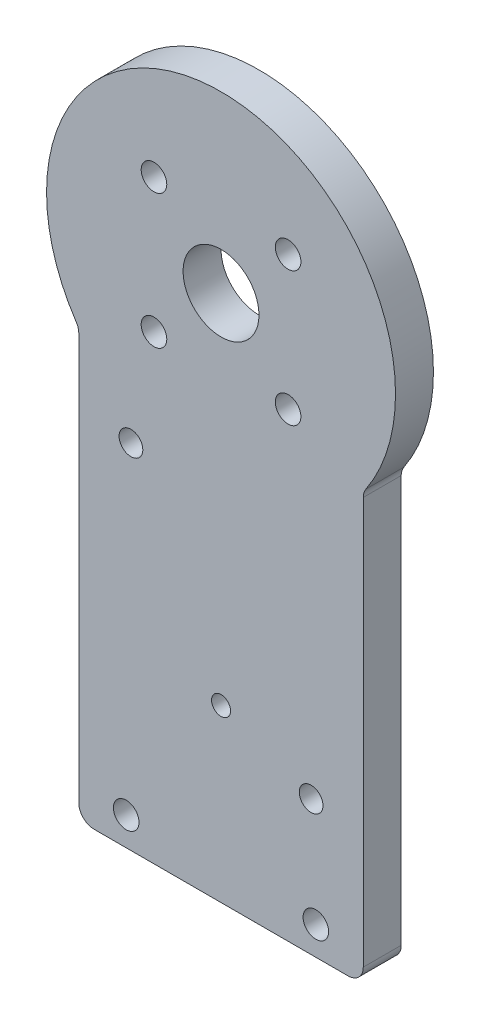
from build123d import *

# Parameters (mm, degrees)
CROQUIS1_R              = 1.35
CROQUIS1_R_2            = 4
CROQUIS1_R_3            = 1.25
SALIENTE_EXTRUIR1_DEPTH = 4
REDONDEO1_R             = 1.6
CROQUIS2_R              = 1
CORTAR_EXTRUIR1_DEPTH   = 4


with BuildPart() as part:
    # Croquis1 → Saliente-Extruir1 (new body)
    with BuildSketch(Plane.XY):
        with BuildLine():
            Line((-15, -10.656453444), (-15, -55.656453444))
            Line((-15, -55.656453444), (15, -55.656453444))
            Line((15, -55.656453444), (15, -10.656453444))
            ThreePointArc((15, -10.656453444), (0, 18.4), (-15, -10.656453444))
        make_face()
        with Locations((-7.071067812, -7.071067812)):
            Circle(CROQUIS1_R, mode=Mode.SUBTRACT)
        with Locations((-7.071067812, 7.071067812)):
            Circle(CROQUIS1_R, mode=Mode.SUBTRACT)
        with Locations((7.071067812, 7.071067812)):
            Circle(CROQUIS1_R, mode=Mode.SUBTRACT)
        with Locations((7.071067812, -7.071067812)):
            Circle(CROQUIS1_R, mode=Mode.SUBTRACT)
        Circle(CROQUIS1_R_2, mode=Mode.SUBTRACT)
        with Locations((-10, -52.656453444)):
            Circle(CROQUIS1_R, mode=Mode.SUBTRACT)
        with Locations(Location((10, -52.656453444, 0), (0, 0, 180))):
            Circle(CROQUIS1_R, mode=Mode.SUBTRACT)
        with Locations((9.5, -41.434010022)):
            Circle(CROQUIS1_R_3, mode=Mode.SUBTRACT)
        with Locations((-9.5, -18.434010022)):
            Circle(CROQUIS1_R_3, mode=Mode.SUBTRACT)
    extrude(amount=SALIENTE_EXTRUIR1_DEPTH)

    # Redondeo1
    redondeo1_edges = [part.edges().sort_by_distance(p)[0] for p in [
        (15, -10.656453444, 2),
        (15, -55.656453444, 2),
        (-15, -55.656453444, 2),
        (-15, -10.656453444, 2),
    ]]
    fillet(redondeo1_edges, radius=REDONDEO1_R)

    # Croquis2 → Cortar-Extruir1 (cut)
    with BuildSketch(Plane.XY.offset(4)):
        with Locations((0, -37.656453444)):
            Circle(CROQUIS2_R)
    extrude(amount=-CORTAR_EXTRUIR1_DEPTH, mode=Mode.SUBTRACT)


solid = part.part
